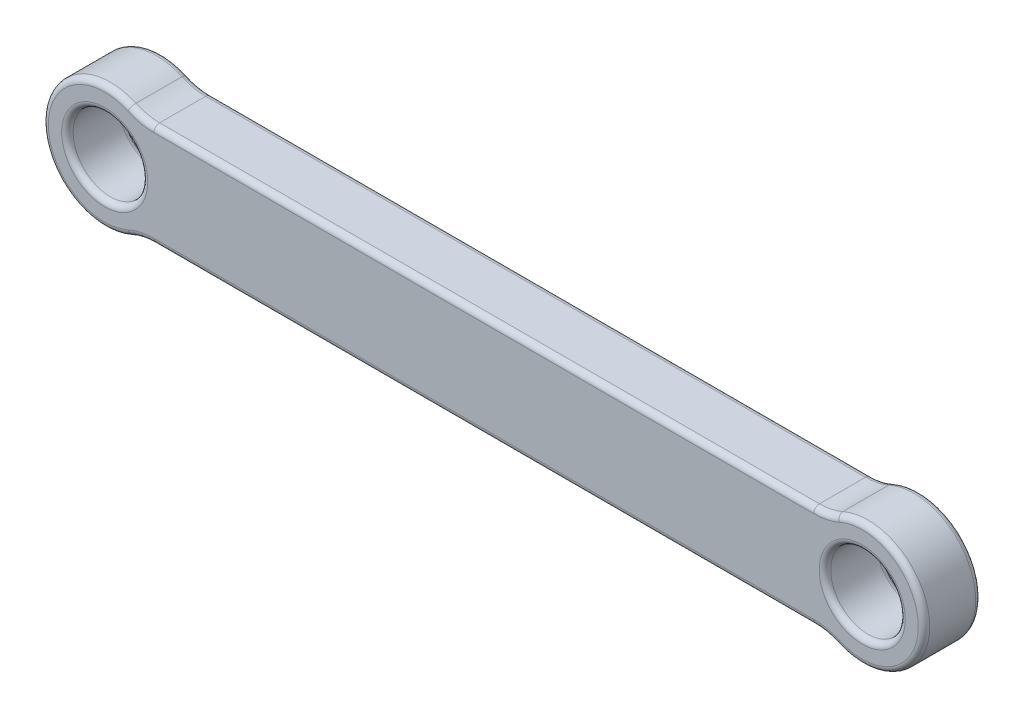
from build123d import *

# Parameters (mm, degrees)
EXTRUDE_1_DEPTH     = 10
SKETCH_2_R          = 6.5
CUT_EXTRUDE_1_DEPTH = 79.216355739
FILLET_1_R          = 10
FILLET_2_R          = 1


with BuildPart() as part:
    # 草图1 → 凸台-拉伸1 (new body)
    with BuildSketch(Plane.XY):
        with BuildLine():
            Line((60.053581818, -8.964047477), (-59.946418182, -8.964047477))
            ThreePointArc((-59.946418182, -8.964047477), (-76.816653826, 0), (-59.946418182, 8.964047477))
            Line((-59.946418182, 8.964047477), (60.053581818, 8.964047477))
            ThreePointArc((60.053581818, 8.964047477), (76.757045894, 0), (60.053581818, -8.964047477))
        make_face()
    extrude(amount=EXTRUDE_1_DEPTH)

    # 草图2 → 切除-拉伸1 (cut, through all)
    with BuildSketch(Plane.XY.offset(10)):
        with Locations((-66, 0)):
            Circle(SKETCH_2_R)
        with Locations((66, 0)):
            Circle(SKETCH_2_R)
    extrude(amount=-CUT_EXTRUDE_1_DEPTH, mode=Mode.SUBTRACT)

    # 圆角1
    fillet_1_edges = [part.edges().sort_by_distance(p)[0] for p in [
        (60.053581818, -8.964047477, 5),
        (-59.946418182, -8.964047477, 5),
        (-59.946418182, 8.964047477, 5),
        (60.053581818, 8.964047477, 5),
    ]]
    fillet(fillet_1_edges, radius=FILLET_1_R)

    # 圆角2
    fillet_2_edges = [part.edges().sort_by_distance(p)[0] for p in [
        (59.5, 0, 0),
        (59.5, 0, 10),
        (-72.5, 0, 0),
        (-72.5, 0, 10),
        (76.757045894, 0, 0),
        (76.757045894, 0, 10),
        (0.072783459, -8.964047477, 0),
        (0.072783459, -8.964047477, 10),
        (-76.816653826, 0, 0),
        (-76.816653826, 0, 10),
        (0.072783459, 8.964047477, 0),
        (0.072783459, 8.964047477, 10),
        (59.639037336, -9.182381543, 0),
        (59.639037336, -9.182381543, 10),
        (-59.524706381, -9.189070129, 0),
        (-59.524706381, -9.189070129, 10),
        (59.639037336, 9.182381543, 0),
        (59.639037336, 9.182381543, 10),
        (-59.524706381, 9.189070129, 0),
        (-59.524706381, 9.189070129, 10),
    ]]
    fillet(fillet_2_edges, radius=FILLET_2_R)


solid = part.part
